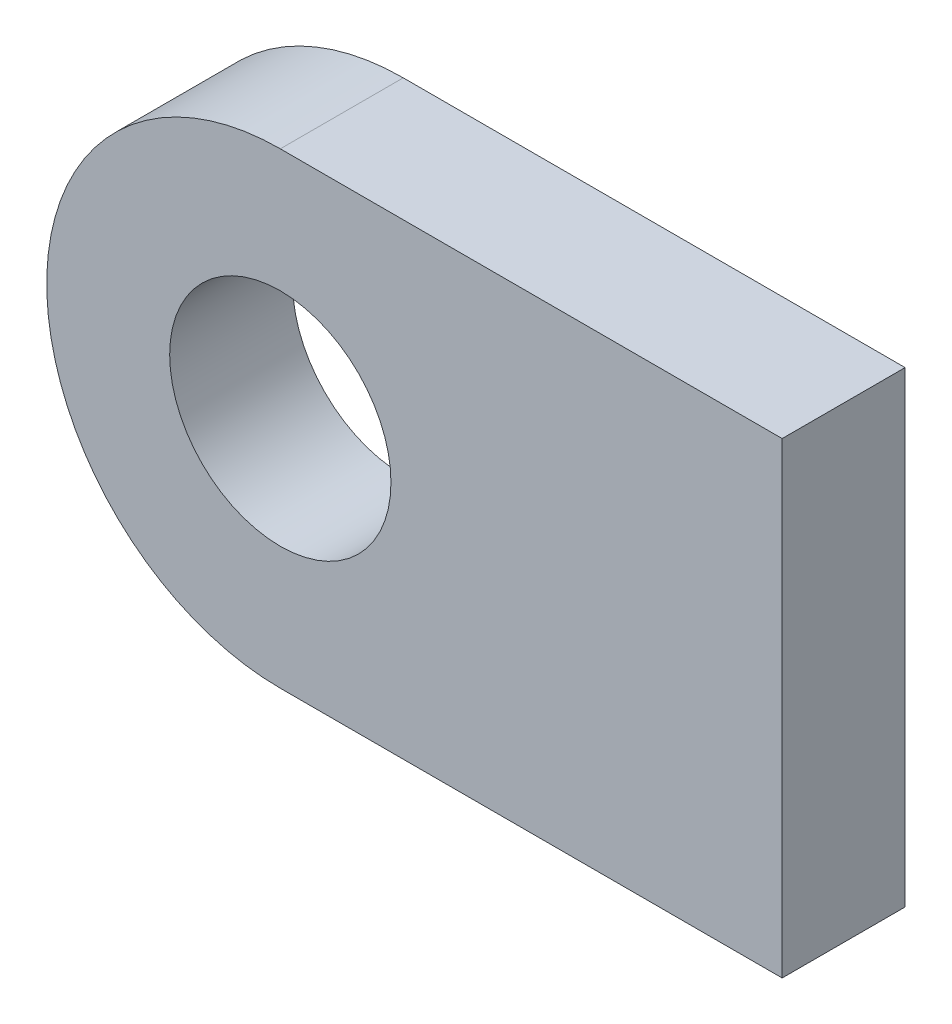
from build123d import *

# Parameters (mm, degrees)
SKETCH1_R           = 4.5
BOSS_EXTRUDE1_DEPTH = 2.5


with BuildPart() as part:
    # Sketch1 → Boss-Extrude1 (new, symmetric)
    with BuildSketch(Plane.XY):
        with BuildLine():
            Line((0, 9.5), (20.41, 9.5))
            Line((20.41, 9.5), (20.41, -9.5))
            Line((20.41, -9.5), (0, -9.5))
            ThreePointArc((0, -9.5), (-9.5, 0), (0, 9.5))
        make_face()
        Circle(SKETCH1_R, mode=Mode.SUBTRACT)
    extrude(amount=BOSS_EXTRUDE1_DEPTH, both=True)


solid = part.part
